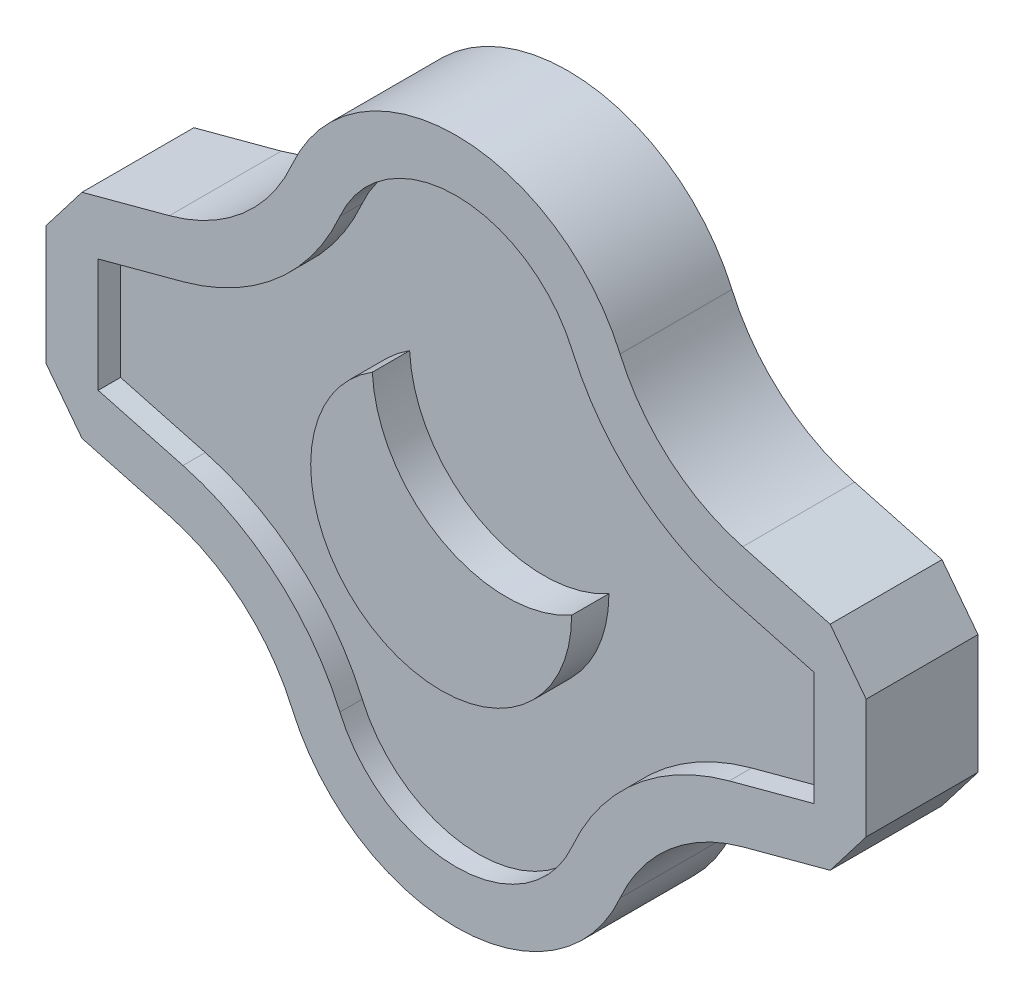
from build123d import *

# Parameters (mm, degrees)
BOSS_EXTRUDE1_DEPTH = 15
CUT_EXTRUDE1_DEPTH  = 3
BOSS_EXTRUDE2_DEPTH = 5
CUT_EXTRUDE2_DEPTH  = 3
CHAMFER1_SIZE       = 5


with BuildPart() as part:
    # Sketch1 → Boss-Extrude1 (new body)
    with BuildSketch(Plane.XY):
        with BuildLine():
            Line((-55, -13), (-55, 13))
            Line((-55, 13), (-38.445821861, 17.435678664))
            ThreePointArc((-38.445821861, 17.435678664), (-28.606816649, 22.636507401), (-21.999819423, 31.592077218))
            ThreePointArc((-21.999819423, 31.592077218), (0, 46), (21.999819423, 31.592077218))
            ThreePointArc((21.999819423, 31.592077218), (28.606816649, 22.636507401), (38.445821861, 17.435678664))
            Line((38.445821861, 17.435678664), (55, 13))
            Line((55, 13), (55, -13))
            Line((55, -13), (38.445821861, -17.435678664))
            ThreePointArc((38.445821861, -17.435678664), (28.606816649, -22.636507401), (21.999819423, -31.592077218))
            ThreePointArc((21.999819423, -31.592077218), (0, -46), (-21.999819423, -31.592077218))
            ThreePointArc((-21.999819423, -31.592077218), (-28.606816649, -22.636507401), (-38.445821861, -17.435678664))
            Line((-38.445821861, -17.435678664), (-55, -13))
        make_face()
    extrude(amount=BOSS_EXTRUDE1_DEPTH)

    # Sketch2 → Cut-Extrude1 (cut)
    with BuildSketch(Plane.XY.offset(15)):
        with BuildLine():
            Line((36.634088545, -10.67419788), (48, -7.628711084))
            Line((48, -7.628711084), (48, 7.628711084))
            Line((48, 7.628711084), (36.634088545, 10.67419788))
            ThreePointArc((36.634088545, 10.67419788), (24.040161874, 17.331258664), (15.583205424, 28.79438803))
            ThreePointArc((15.583205424, 28.79438803), (0, 39), (-15.583205424, 28.79438803))
            ThreePointArc((-15.583205424, 28.79438803), (-24.040161874, 17.331258664), (-36.634088545, 10.67419788))
            Line((-36.634088545, 10.67419788), (-48, 7.628711084))
            Line((-48, 7.628711084), (-48, -7.628711084))
            Line((-48, -7.628711084), (-36.634088545, -10.67419788))
            ThreePointArc((-36.634088545, -10.67419788), (-24.040161874, -17.331258664), (-15.583205424, -28.79438803))
            ThreePointArc((-15.583205424, -28.79438803), (0, -39), (15.583205424, -28.79438803))
            ThreePointArc((15.583205424, -28.79438803), (24.040161874, -17.331258664), (36.634088545, -10.67419788))
        make_face()
    extrude(amount=-CUT_EXTRUDE1_DEPTH, mode=Mode.SUBTRACT)

    # Sketch3 → Boss-Extrude2 (add)
    with BuildSketch(Plane.XY.offset(12)):
        with BuildLine():
            ThreePointArc((-9.229359568, 14.868386663), (-8.506944444, -15.293197711), (17.5, 0))
            ThreePointArc((17.5, 0), (0, 0), (-9.229359568, 14.868386663))
        make_face()
    extrude(amount=BOSS_EXTRUDE2_DEPTH)

    # Sketch4 → Cut-Extrude2 (cut)
    with BuildSketch(Plane(origin=(0, 0, 0), x_dir=(-1, 0, 0), z_dir=(0, 0, -1))):
        with BuildLine():
            ThreePointArc((-17.5, 0), (0, -17.5), (17.5, 0))
            ThreePointArc((17.5, 0), (15.293197711, 8.506944444), (9.229359568, 14.868386663))
            ThreePointArc((9.229359568, 14.868386663), (0, 0), (-17.5, 0))
        make_face()
    extrude(amount=-CUT_EXTRUDE2_DEPTH, mode=Mode.SUBTRACT)

    # Chamfer1
    chamfer1_edges = [part.edges().sort_by_distance(p)[0] for p in [
        (55, -13, 7.5),
        (55, 13, 7.5),
        (-55, 13, 7.5),
        (-55, -13, 7.5),
    ]]
    chamfer(chamfer1_edges, length=CHAMFER1_SIZE)


solid = part.part
